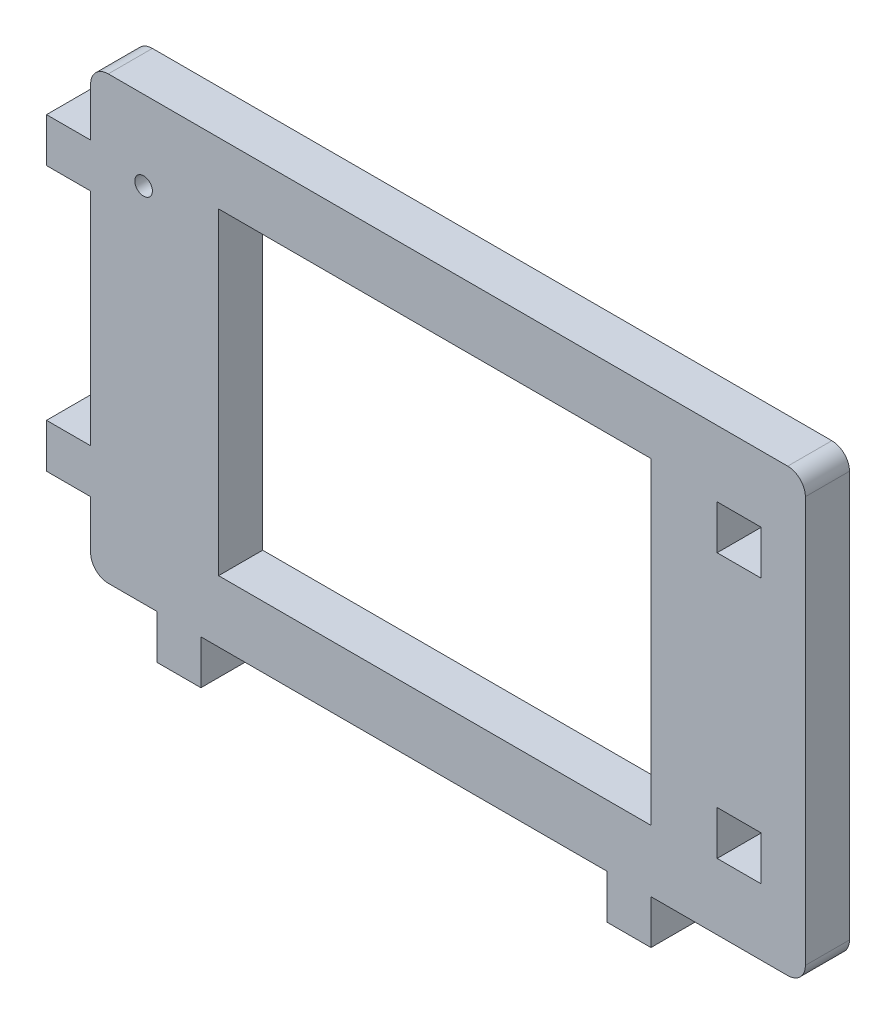
from build123d import *

# Parameters (mm, degrees)
ESQUISSE1_R        = 1
ESQUISSE1_W        = 5
ESQUISSE1_H        = 5
ESQUISSE1_W_2      = 49
ESQUISSE1_H_2      = 36
BOSS_EXTRU_1_DEPTH = 5
CONG_1_R           = 2


with BuildPart() as part:
    # Esquisse1 → Boss.-Extru.1 (new body)
    with BuildSketch(Plane.XY):
        Polygon((0, 0), (7.5, 0), (7.5, -5), (12.5, -5), (12.5, 0), (58.5, 0), (58.5, -5), (63.5, -5), (63.5, 0), (71, 0), (81, 0), (81, 50), (71, 50), (0, 50), (0, 42.5), (-5, 42.5), (-5, 37.5), (0, 37.5), (0, 12.5), (-5, 12.5), (-5, 7.5), (0, 7.5), align=None)
        with Locations((6, 41)):
            Circle(ESQUISSE1_R, mode=Mode.SUBTRACT)
        with Locations((73.5, 10)):
            Rectangle(ESQUISSE1_W, ESQUISSE1_H, mode=Mode.SUBTRACT)
        with Locations((73.5, 40)):
            Rectangle(ESQUISSE1_W, ESQUISSE1_H, mode=Mode.SUBTRACT)
        with Locations((39, 25)):
            Rectangle(ESQUISSE1_W_2, ESQUISSE1_H_2, mode=Mode.SUBTRACT)
    extrude(amount=BOSS_EXTRU_1_DEPTH)

    # Congé1
    cong_1_edges = [part.edges().sort_by_distance(p)[0] for p in [
        (0, 50, 2.5),
        (81, 50, 2.5),
        (81, 0, 2.5),
        (0, 0, 2.5),
    ]]
    fillet(cong_1_edges, radius=CONG_1_R)


solid = part.part
